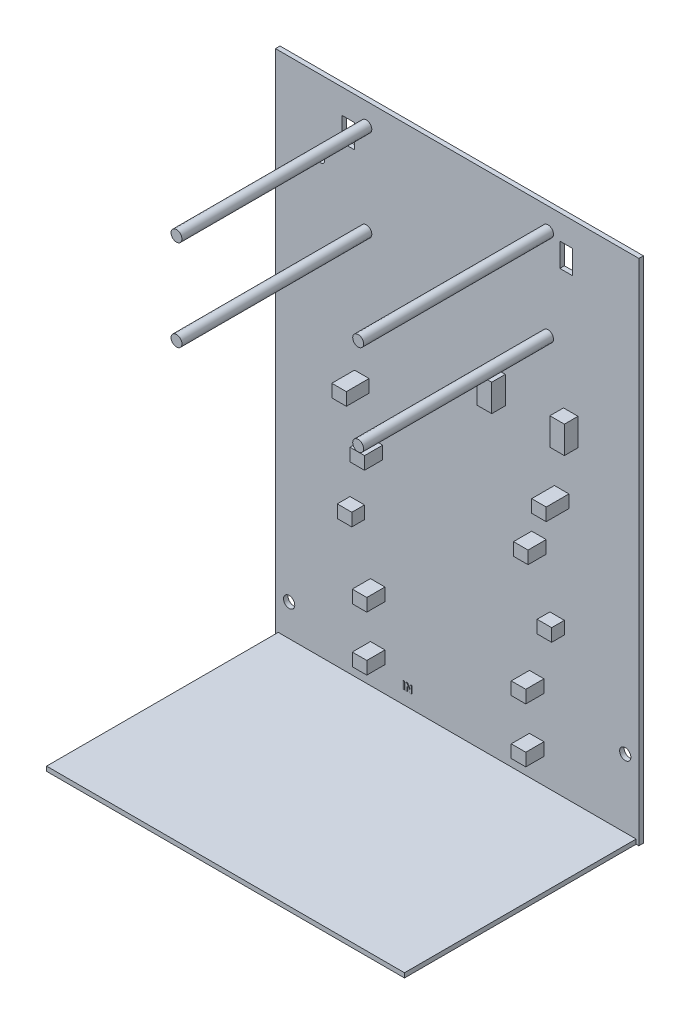
from build123d import *

# Parameters (mm, degrees)
SKETCH1_W                  = 400
SKETCH1_H                  = 560
PANEL_DEPTH                = 5
SKETCH2_W                  = 394
SKETCH2_H                  = 255
SHELF_DEPTH                = 5
WALL_KEYHOLES_DEPTH        = 649.999229584
WALL_KEYHOLES_DEPTH_BACK   = 649.999229584
SKETCH3_W                  = 14
SKETCH3_H                  = 26
CONNECTOR_HOLES_DEPTH      = 649.999229584
CONNECTOR_HOLES_DEPTH_BACK = 649.999229584
SKETCH4_R                  = 6.2
SKETCH4_R_2                = 4.1
MODULE_POSTS_START         = 5
SKETCH5_R                  = 6
MODULE_POSTS_DEPTH         = 209
SADDLES_SED_START          = 5
SKETCH6_W                  = 16
SKETCH6_H                  = 14
SADDLES_SED_DEPTH          = 20
SADDLES_CARB_START         = 5
SKETCH7_W                  = 16
SKETCH7_H                  = 14
SADDLES_CARB_DEPTH         = 20
SADDLES_RO_START           = 5
SKETCH8_W                  = 16
SKETCH8_H                  = 14
SADDLES_RO_DEPTH           = 14
SADDLES_UF_START           = 5
SKETCH9_W                  = 16
SKETCH9_H                  = 14
SADDLES_UF_DEPTH           = 20
SADDLES_UVC_START          = 5
SKETCH10_W                 = 16
SKETCH10_H                 = 14
SADDLES_UVC_DEPTH          = 25
PUMP_MOUNT_POSTS_START     = 5
SKETCH11_W                 = 16
SKETCH11_H                 = 30
PUMP_MOUNT_POSTS_DEPTH     = 15
LABEL_IN_START             = 5
SKETCH12_W                 = 1.538461538
SKETCH12_H                 = 8
LABEL_IN_DEPTH             = 0.6


with BuildPart() as part:
    # Sketch1 → Panel (new body)
    with BuildSketch(Plane.XY):
        with Locations((0, 280)):
            Rectangle(SKETCH1_W, SKETCH1_H)
    extrude(amount=PANEL_DEPTH)

    # Sketch2 → Shelf (add)
    with BuildSketch(Plane(origin=(0, 0, 0), x_dir=(1, 0, 0), z_dir=(0, 1, 0))):
        with Locations((0, -132.5)):
            Rectangle(SKETCH2_W, SKETCH2_H)
    extrude(amount=SHELF_DEPTH)

    # Sketch3 → Wall_Keyholes (cut, two sides: drawn at the far end of the back side and taken through both)
    with BuildSketch(Plane.XY.offset(-WALL_KEYHOLES_DEPTH_BACK)):
        with Locations((-120, 520)):
            Rectangle(SKETCH3_W, SKETCH3_H)
        with Locations((120, 520)):
            Rectangle(SKETCH3_W, SKETCH3_H)
    extrude(amount=WALL_KEYHOLES_DEPTH + WALL_KEYHOLES_DEPTH_BACK, mode=Mode.SUBTRACT)

    # Sketch4 → Connector_Holes (cut, two sides: drawn at the far end of the back side and taken through both)
    with BuildSketch(Plane.XY.offset(-CONNECTOR_HOLES_DEPTH_BACK)):
        with Locations((-185, 40)):
            Circle(SKETCH4_R)
        with Locations((185, 80)):
            Circle(SKETCH4_R)
        with Locations((-150, 480)):
            Circle(SKETCH4_R_2)
    extrude(amount=CONNECTOR_HOLES_DEPTH + CONNECTOR_HOLES_DEPTH_BACK, mode=Mode.SUBTRACT)

    # Sketch5 → Module_Posts (add)
    with BuildSketch(Plane.XY.offset(MODULE_POSTS_START)):
        with Locations((-100, 436)):
            Circle(SKETCH5_R)
        with Locations((-100, 536)):
            Circle(SKETCH5_R)
        with Locations((100, 436)):
            Circle(SKETCH5_R)
        with Locations((100, 536)):
            Circle(SKETCH5_R)
    extrude(amount=MODULE_POSTS_DEPTH)

    # Sketch6 → Saddles_SED (add)
    with BuildSketch(Plane.XY.offset(SADDLES_SED_START)):
        with Locations((-87.5, 40)):
            Rectangle(SKETCH6_W, SKETCH6_H)
        with Locations((87.5, 40)):
            Rectangle(SKETCH6_W, SKETCH6_H)
    extrude(amount=SADDLES_SED_DEPTH)

    # Sketch7 → Saddles_CARB (add)
    with BuildSketch(Plane.XY.offset(SADDLES_CARB_START)):
        with Locations((-87.5, 100)):
            Rectangle(SKETCH7_W, SKETCH7_H)
        with Locations((87.5, 100)):
            Rectangle(SKETCH7_W, SKETCH7_H)
    extrude(amount=SADDLES_CARB_DEPTH)

    # Sketch8 → Saddles_RO (add)
    with BuildSketch(Plane.XY.offset(SADDLES_RO_START)):
        with Locations((-110, 167)):
            Rectangle(SKETCH8_W, SKETCH8_H)
        with Locations((110, 167)):
            Rectangle(SKETCH8_W, SKETCH8_H)
    extrude(amount=SADDLES_RO_DEPTH)

    # Sketch9 → Saddles_UF (add)
    with BuildSketch(Plane.XY.offset(SADDLES_UF_START)):
        with Locations((-90, 234)):
            Rectangle(SKETCH9_W, SKETCH9_H)
        with Locations((90, 234)):
            Rectangle(SKETCH9_W, SKETCH9_H)
    extrude(amount=SADDLES_UF_DEPTH)

    # Sketch10 → Saddles_UVC (add)
    with BuildSketch(Plane.XY.offset(SADDLES_UVC_START)):
        with Locations((-105, 290)):
            Rectangle(SKETCH10_W, SKETCH10_H)
        with Locations((115, 290)):
            Rectangle(SKETCH10_W, SKETCH10_H)
    extrude(amount=SADDLES_UVC_DEPTH)

    # Sketch11 → Pump_Mount_Posts (add)
    with BuildSketch(Plane.XY.offset(PUMP_MOUNT_POSTS_START)):
        with Locations((45, 361)):
            Rectangle(SKETCH11_W, SKETCH11_H)
        with Locations((125, 361)):
            Rectangle(SKETCH11_W, SKETCH11_H)
    extrude(amount=PUMP_MOUNT_POSTS_DEPTH)

    # Sketch12 → Label_IN (add)
    with BuildSketch(Plane.XY.offset(LABEL_IN_START)):
        with Locations((-58.512820513, 24)):
            Rectangle(SKETCH12_W, SKETCH12_H)
        Polygon((-56.102564103, 20), (-56.102564103, 28), (-54.495192308, 28), (-51.282051282, 22.740384615), (-51.282051282, 28), (-49.743589744, 28), (-49.743589744, 20), (-51.400641026, 20), (-54.564102564, 25.176282051), (-54.564102564, 20), align=None)
    extrude(amount=LABEL_IN_DEPTH)


solid = part.part
